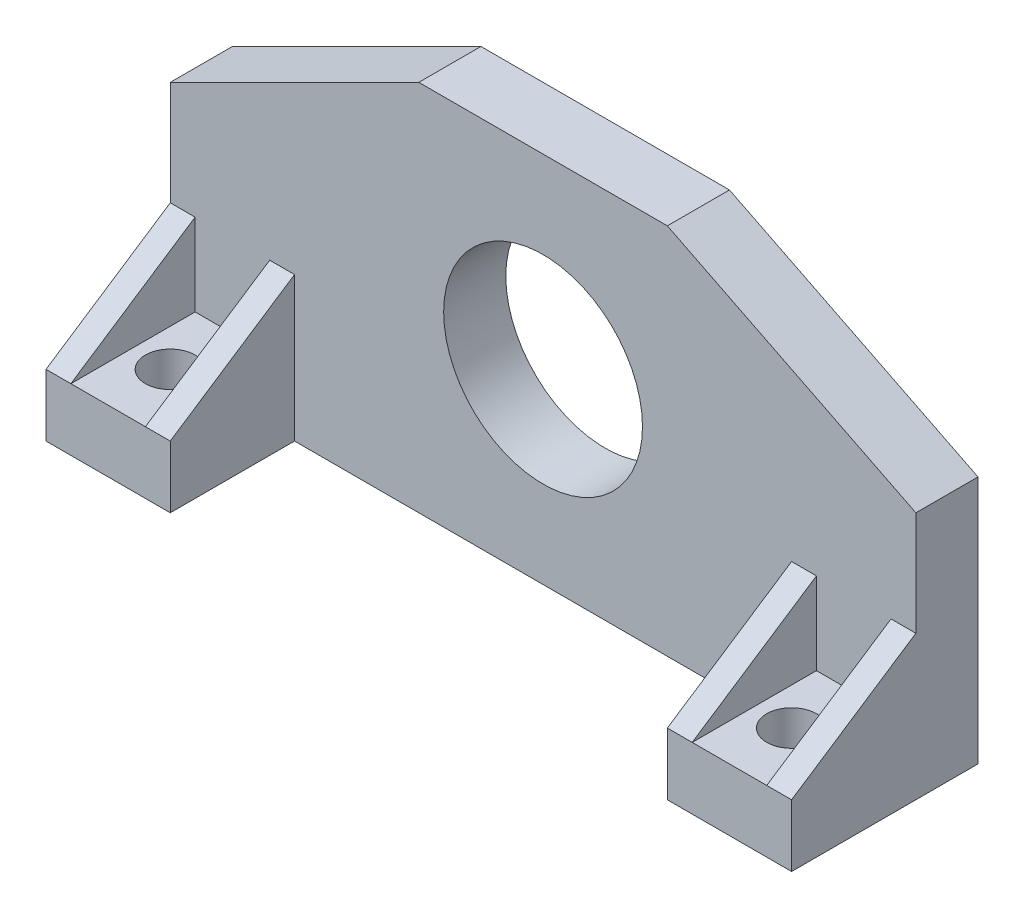
from build123d import *

# Parameters (mm, degrees)
ESQUISSE1_W             = 60
ESQUISSE1_H             = 30
BOSS_EXTRU_1_DEPTH      = 5
ESQUISSE2_R             = 8
ENL_V_MAT_EXTRU_1_DEPTH = 5
ESQUISSE4_W             = 10
ESQUISSE4_H             = 5
BOSS_EXTRU_2_DEPTH      = 10
ESQUISSE6_R             = 2
ENL_V_MAT_EXTRU_2_DEPTH = 10
BOSS_EXTRU_3_DEPTH      = 2
SYM_TRIE4_COPY_1_DEPTH  = 2
ENL_V_MAT_EXTRU_3_DEPTH = 68.823299831


with BuildPart() as part:
    # Esquisse1 → Boss.-Extru.1 (new body)
    with BuildSketch(Plane.XY):
        with Locations((30, 15)):
            Rectangle(ESQUISSE1_W, ESQUISSE1_H)
    extrude(amount=BOSS_EXTRU_1_DEPTH)

    # Esquisse2 → Enlèv. mat.-Extru.1 (cut)
    with BuildSketch(Plane.XY.offset(5)):
        with Locations((30, 15)):
            Circle(ESQUISSE2_R)
    extrude(amount=-ENL_V_MAT_EXTRU_1_DEPTH, mode=Mode.SUBTRACT)

    # Esquisse4 → Boss.-Extru.2 (add)
    with BuildSketch(Plane.XY.offset(5)):
        with Locations((55, 2.5)):
            Rectangle(ESQUISSE4_W, ESQUISSE4_H)
    boss_extru_2 = extrude(amount=BOSS_EXTRU_2_DEPTH)

    # Symétrie1: Boss.-Extru.2 across plane
    add(boss_extru_2.mirror(Plane(origin=(30, 0, 0), x_dir=(0, 0, 1), z_dir=(1, 0, 0))))

    # Esquisse6 → Enlèv. mat.-Extru.2 (cut)
    with BuildSketch(Plane(origin=(0, 5, 0), x_dir=(1, 0, 0), z_dir=(0, 1, 0))):
        with Locations(Location((5, -10, 0), (0, 0, 180))):
            Circle(ESQUISSE6_R)
    enl_v_mat_extru_2 = extrude(amount=-ENL_V_MAT_EXTRU_2_DEPTH, mode=Mode.SUBTRACT)

    # Symétrie2: Enlèv. mat.-Extru.2 across plane
    add(enl_v_mat_extru_2.mirror(Plane(origin=(30, 0, 0), x_dir=(0, 0, 1), z_dir=(1, 0, 0))), mode=Mode.SUBTRACT)

    # Esquisse13 → Boss.-Extru.3 (add)
    with BuildSketch(Plane.ZY):
        Polygon((15, 5), (5, 11.605187872), (5, 5), align=None)
    boss_extru_3 = extrude(amount=-BOSS_EXTRU_3_DEPTH)

    # Symétrie3: Boss.-Extru.3 across plane
    add(boss_extru_3.mirror(Plane.ZY.offset(-5)))

    # Symétrie4: Boss.-Extru.3 across plane
    add(boss_extru_3.mirror(Plane(origin=(30, 0, 0), x_dir=(0, 0, 1), z_dir=(1, 0, 0))))

    # Symétrie4 copy 1 sketch → Symétrie4 copy 1 (add)
    with BuildSketch(Plane.ZY.offset(-50)):
        Polygon((15, 5), (5, 11.605187872), (5, 5), align=None)
    extrude(amount=-SYM_TRIE4_COPY_1_DEPTH)

    # Esquisse14 → Enlèv. mat.-Extru.3 (cut, through all)
    with BuildSketch(Plane.XY.offset(5)):
        Polygon((20, 30), (0, 20), (0, 30), align=None)
    enl_v_mat_extru_3 = extrude(amount=-ENL_V_MAT_EXTRU_3_DEPTH, mode=Mode.SUBTRACT)

    # Symétrie5: Enlèv. mat.-Extru.3 across plane
    add(enl_v_mat_extru_3.mirror(Plane(origin=(30, 0, 0), x_dir=(0, 0, 1), z_dir=(1, 0, 0))), mode=Mode.SUBTRACT)


solid = part.part
